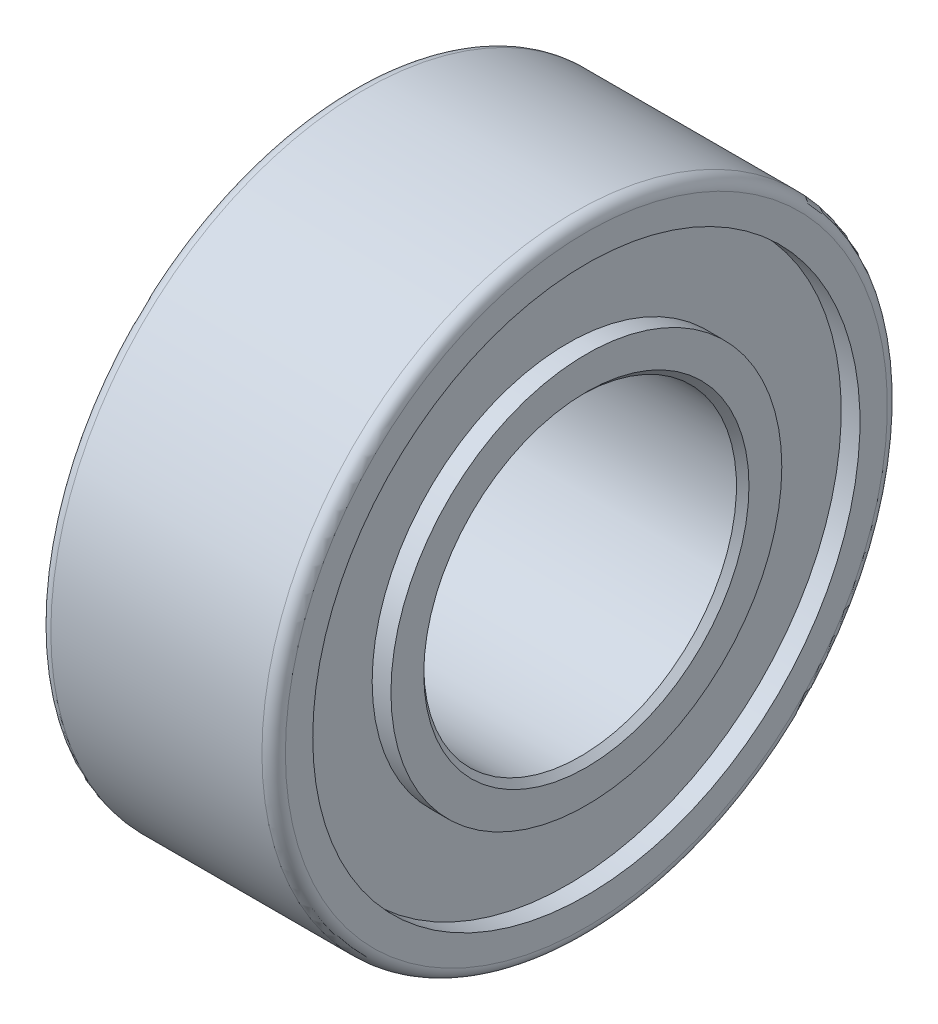
from build123d import *


with BuildPart() as part:
    # Sketch1 → Revolve1 (revolve)
    with BuildSketch(Plane(origin=(0, 0, 0), x_dir=(-1, 0, 0), z_dir=(0, 0, -1)), mode=Mode.PRIVATE) as revolve1_sk:
        with BuildLine():
            Line((-2.38125, 3.302), (-2.25425, 3.175))
            Line((-2.25425, 3.175), (2.25425, 3.175))
            Line((2.25425, 3.175), (2.38125, 3.302))
            Line((2.38125, 3.302), (2.38125, 3.96875))
            Line((2.38125, 3.96875), (2.00025, 3.96875))
            Line((2.00025, 3.96875), (2.00025, 5.55625))
            Line((2.00025, 5.55625), (2.38125, 5.55625))
            Line((2.38125, 5.55625), (2.38125, 6.111875))
            ThreePointArc((2.38125, 6.111875), (2.311504802, 6.280254802), (2.143125, 6.35))
            Line((2.143125, 6.35), (-2.143125, 6.35))
            ThreePointArc((-2.143125, 6.35), (-2.311504802, 6.280254802), (-2.38125, 6.111875))
            Line((-2.38125, 6.111875), (-2.38125, 5.55625))
            Line((-2.38125, 5.55625), (-2.00025, 5.55625))
            Line((-2.00025, 5.55625), (-2.00025, 3.96875))
            Line((-2.00025, 3.96875), (-2.38125, 3.96875))
            Line((-2.38125, 3.96875), (-2.38125, 3.302))
        make_face()
    revolve(revolve1_sk.sketch.rotate(Axis((2.382500003, 0, 0), (-1, 0, 0)), 270), axis=Axis((2.382500003, 0, 0), (-1, 0, 0)))


solid = part.part
